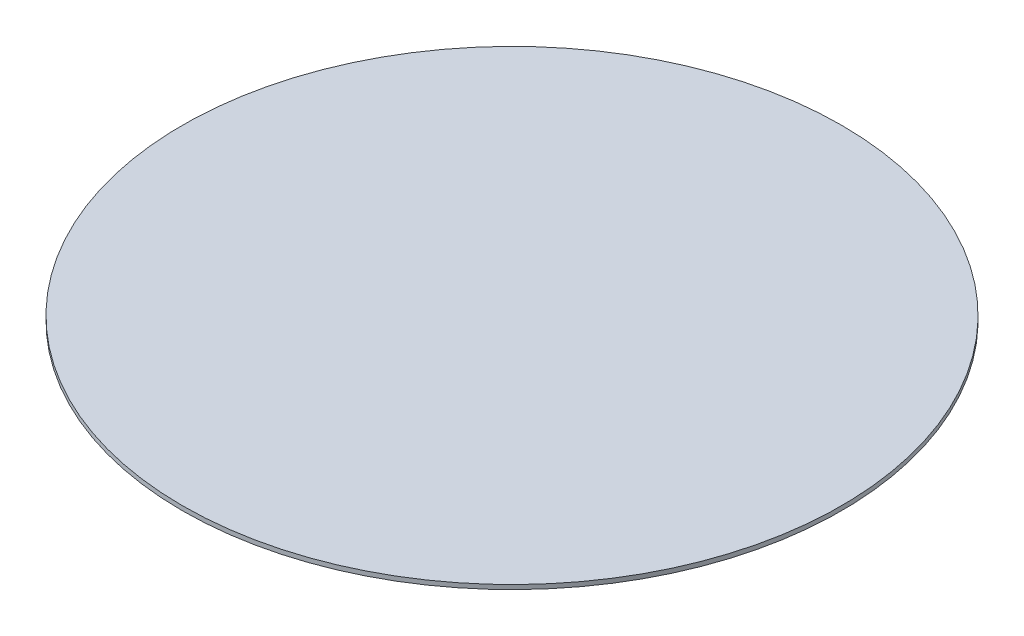
from build123d import *

# Parameters (mm, degrees)
SKETCH1_R           = 60
BOSS_EXTRUDE1_DEPTH = 0.8


with BuildPart() as part:
    # Sketch1 → Boss-Extrude1 (new body)
    with BuildSketch(Plane(origin=(0, 0, 0), x_dir=(1, 0, 0), z_dir=(0, 1, 0))):
        with Locations(Location((0, 0, 0), (0, 0, 270))):
            Circle(SKETCH1_R)
    extrude(amount=BOSS_EXTRUDE1_DEPTH)


solid = part.part
